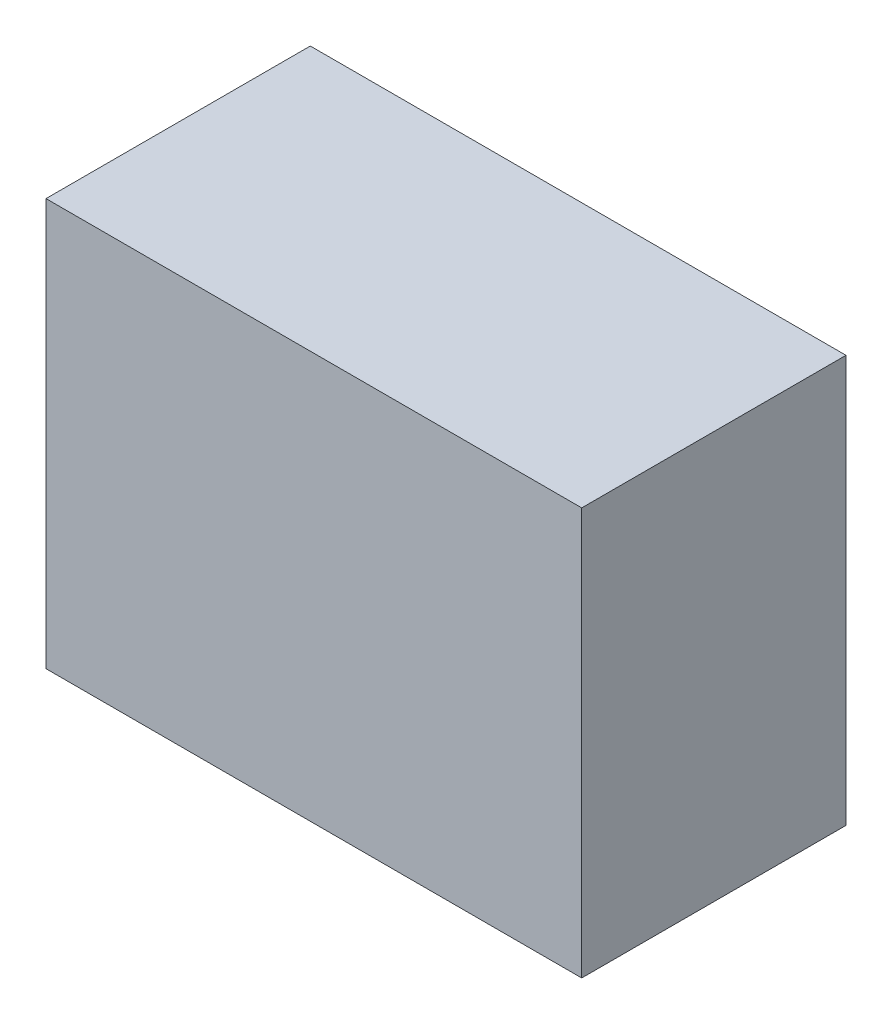
from build123d import *

# Parameters (mm, degrees)
SKETCH_1_W      = 75
SKETCH_1_H      = 57
EXTRUDE_1_DEPTH = 37


with BuildPart() as part:
    # 스케치1 → 보스-돌출1 (new body)
    with BuildSketch(Plane.XY):
        with Locations((37.5, 28.5)):
            Rectangle(SKETCH_1_W, SKETCH_1_H)
    extrude(amount=EXTRUDE_1_DEPTH)


solid = part.part
